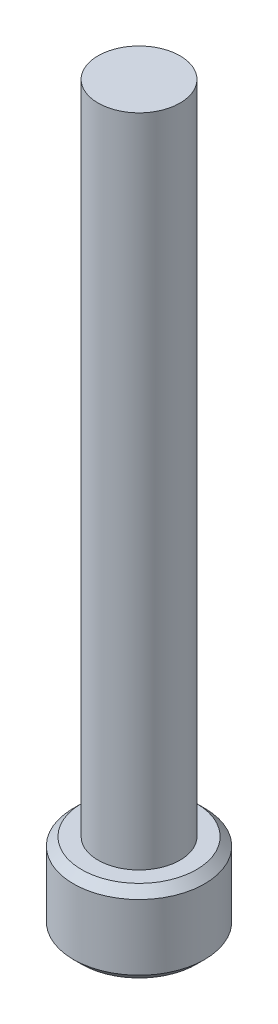
from build123d import *

# Parameters (mm, degrees)
SKETCH1_R           = 2.5
BOSS_EXTRUDE1_DEPTH = 40
SKETCH3_W           = 4
SKETCH3_H           = 5
CUT_EXTRUDE1_START  = -1
CUT_EXTRUDE1_DEPTH  = 30
CHAMFER1_SIZE       = 0.5


with BuildPart() as part:
    # Sketch1 → Boss-Extrude1 (new body)
    with BuildSketch(Plane(origin=(0, 0, 0), x_dir=(1, 0, 0), z_dir=(0, 1, 0))):
        with Locations(Location((0, 0, 0), (0, 0, 270))):
            Circle(SKETCH1_R)
    extrude(amount=BOSS_EXTRUDE1_DEPTH)

    # Sketch3 → Revolve1 (revolve)
    with BuildSketch(Plane.XY, mode=Mode.PRIVATE) as revolve1_sk:
        with Locations((-2, -2.5)):
            Rectangle(SKETCH3_W, SKETCH3_H)
    revolve(revolve1_sk.sketch.rotate(Axis((0, -5, 0), (0, 1, 0)), 270), axis=Axis((0, -5, 0), (0, 1, 0)))

    # Sketch4 → Cut-Extrude1 (cut)
    with BuildSketch(Plane(origin=(0, 0, 0), x_dir=(1, 0, 0), z_dir=(0, 1, 0)).offset(CUT_EXTRUDE1_START)):
        Polygon((2.886751346, 0), (1.443375673, 2.5), (-1.443375673, 2.5), (-2.886751346, 0), (-1.443375673, -2.5), (1.443375673, -2.5), align=None)
    extrude(amount=-CUT_EXTRUDE1_DEPTH, mode=Mode.SUBTRACT)

    # Chamfer1
    chamfer1_edges = [part.edges().sort_by_distance(p)[0] for p in [
        (0, 0, 4),
        (0, -5, 4),
    ]]
    chamfer(chamfer1_edges, length=CHAMFER1_SIZE)


solid = part.part
